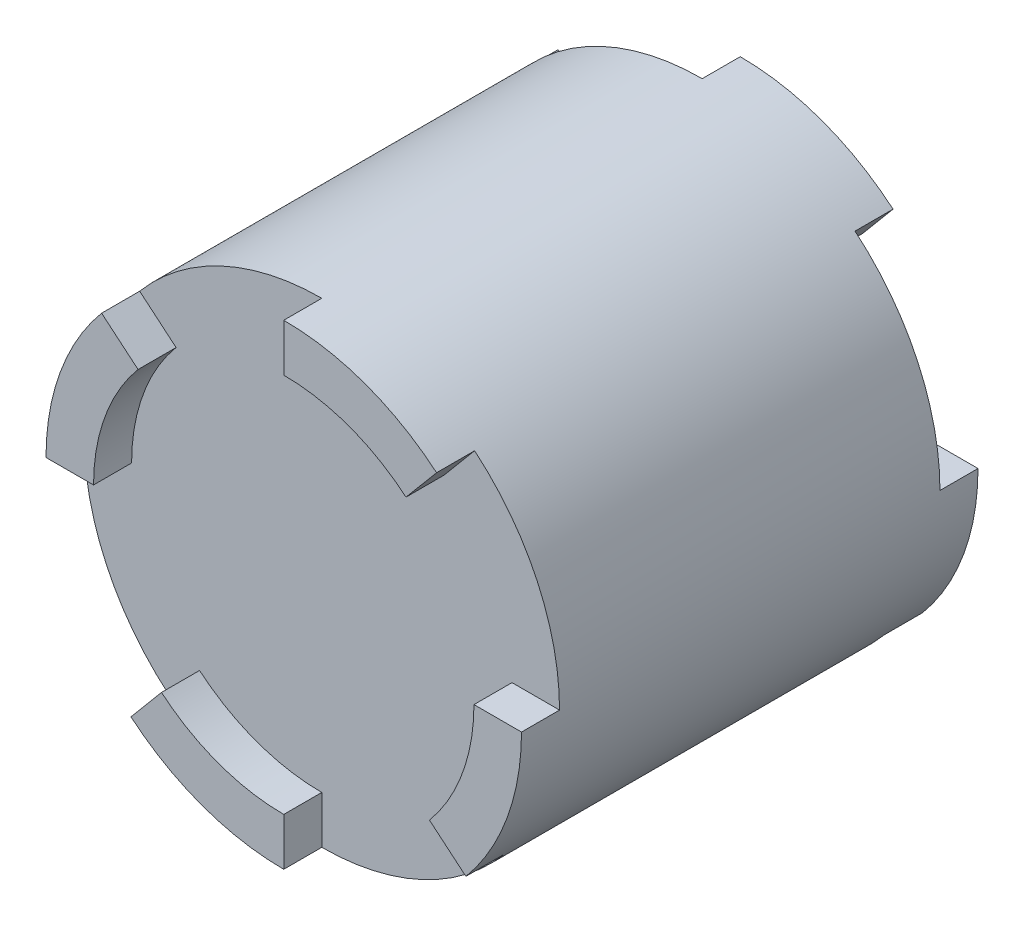
from build123d import *

# Parameters (mm, degrees)
SKETCH1_R           = 25
BOSS_EXTRUDE1_DEPTH = 20
BOSS_EXTRUDE2_START = 4
BOSS_EXTRUDE2_DEPTH = 4


with BuildPart() as part:
    # Sketch1 → Boss-Extrude1 (new, symmetric)
    with BuildSketch(Plane.XY):
        Circle(SKETCH1_R)
    extrude(amount=BOSS_EXTRUDE1_DEPTH, both=True)

    # Sketch2 → Boss-Extrude2 (add)
    with BuildSketch(Plane.XY.offset(20).offset(BOSS_EXTRUDE2_START)):
        with BuildLine():
            Line((-25, 0), (-20, 0))
            ThreePointArc((-20, 0), (-18.793852416, 6.840402867), (-15.320888862, 12.855752194))
            Line((-15.320888862, 12.855752194), (-19.151111078, 16.069690242))
            ThreePointArc((-19.151111078, 16.069690242), (-23.49231552, 8.550503583), (-25, 0))
        make_face()
        with BuildLine():
            Line((16.069690242, 19.151111078), (12.855752194, 15.320888862))
            ThreePointArc((12.855752194, 15.320888862), (6.840402867, 18.793852416), (0, 20))
            Line((0, 20), (0, 25))
            ThreePointArc((0, 25), (8.550503583, 23.49231552), (16.069690242, 19.151111078))
        make_face()
        with BuildLine():
            Line((25, 0), (20, 0))
            ThreePointArc((20, 0), (18.793852416, -6.840402867), (15.320888862, -12.855752194))
            Line((15.320888862, -12.855752194), (19.151111078, -16.069690242))
            ThreePointArc((19.151111078, -16.069690242), (23.49231552, -8.550503583), (25, 0))
        make_face()
        with BuildLine():
            Line((0, -20), (0, -25))
            ThreePointArc((0, -25), (-8.550503583, -23.49231552), (-16.069690242, -19.151111078))
            Line((-16.069690242, -19.151111078), (-12.855752194, -15.320888862))
            ThreePointArc((-12.855752194, -15.320888862), (-6.840402867, -18.793852416), (0, -20))
        make_face()
    boss_extrude2 = extrude(amount=-BOSS_EXTRUDE2_DEPTH)

    # Mirror1: Boss-Extrude2 across plane
    add(boss_extrude2.mirror(Plane.XY))


solid = part.part
